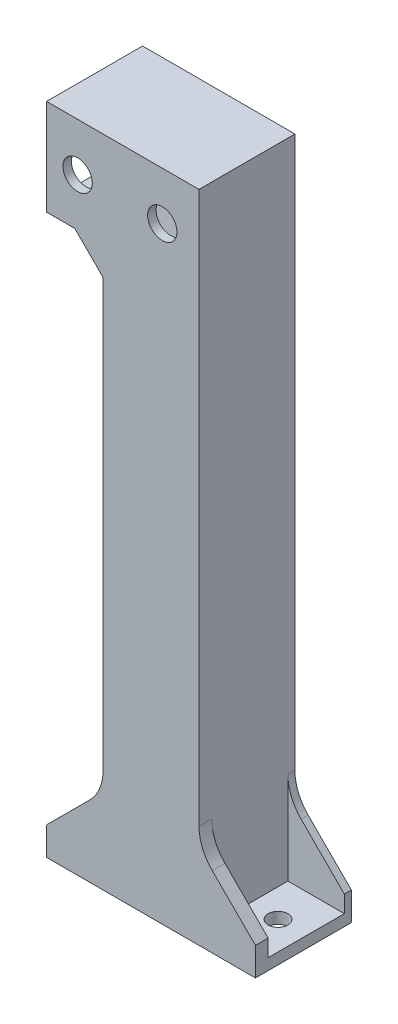
from build123d import *

# Parameters (mm, degrees)
BASE_SHAPE_DEPTH    = 17
SKETCH4_W           = 10
SKETCH4_H           = 13.5
WING_CUT_OUTS_DEPTH = 16.5
SKETCH5_R           = 1.75
WING_HOLES_DEPTH    = 119.380741677
SKETCH7_W           = 14
SKETCH7_H           = 14
CUT_EXTRUDE1_DEPTH  = 114.5
SKETCH8_W           = 14
SKETCH8_H           = 14
CUT_EXTRUDE2_DEPTH  = 25.5
CUT_EXTRUDE3_DEPTH  = 14
SKETCH10_R          = 2.6
CUT_EXTRUDE4_DEPTH  = 121.307938225


with BuildPart() as part:
    # Sketch1 → Base Shape (new body)
    with BuildSketch(Plane.XY):
        with BuildLine():
            Line((0, 18.313708499), (0, 94))
            Line((0, 94), (-5, 99))
            Line((-5, 99), (-10, 99))
            Line((-10, 99), (-10, 116))
            Line((-10, 116), (17, 116))
            Line((17, 116), (17, 18.313708499))
            ThreePointArc((17, 18.313708499), (17.60896374, 15.25224104), (19.343145751, 12.656854249))
            Line((19.343145751, 12.656854249), (27, 5))
            Line((27, 5), (27, 0))
            Line((27, 0), (17, 0))
            Line((17, 0), (0, 0))
            Line((0, 0), (-10, 0))
            Line((-10, 0), (-10, 5))
            Line((-10, 5), (-2.343145751, 12.656854249))
            ThreePointArc((-2.343145751, 12.656854249), (-0.60896374, 15.25224104), (0, 18.313708499))
        make_face()
    extrude(amount=BASE_SHAPE_DEPTH)

    # Sketch4 → Wing Cut Outs (cut)
    with BuildSketch(Plane(origin=(0, 2, 0), x_dir=(-1, 0, 0), z_dir=(0, -1, 0))):
        with Locations((5, -8)):
            Rectangle(SKETCH4_W, SKETCH4_H)
    wing_cut_outs = extrude(amount=-WING_CUT_OUTS_DEPTH, mode=Mode.SUBTRACT)

    # Sketch5 → Wing Holes (cut, through all)
    with BuildSketch(Plane(origin=(0, 2, 0), x_dir=(-1, 0, 0), z_dir=(0, -1, 0))):
        with Locations(Location((5, -8, 0), (0, 0, 180))):
            Circle(SKETCH5_R)
    wing_holes = extrude(amount=WING_HOLES_DEPTH, mode=Mode.SUBTRACT)

    # Mirror1: Wing Cut Outs across plane
    add(wing_cut_outs.mirror(Plane(origin=(8.5, 0, 0), x_dir=(0, 0, 1), z_dir=(1, 0, 0))), mode=Mode.SUBTRACT)

    # Mirror2: Wing Holes across plane
    add(wing_holes.mirror(Plane(origin=(8.5, 0, 0), x_dir=(0, 0, 1), z_dir=(1, 0, 0))), mode=Mode.SUBTRACT)

    # Sketch7 → Cut-Extrude1 (cut)
    with BuildSketch(Plane(origin=(0, 0, 0), x_dir=(1, 0, 0), z_dir=(0, 1, 0))):
        with Locations((8.5, -8.5)):
            Rectangle(SKETCH7_W, SKETCH7_H)
    extrude(amount=CUT_EXTRUDE1_DEPTH, mode=Mode.SUBTRACT)

    # Sketch8 → Cut-Extrude2 (cut)
    with BuildSketch(Plane(origin=(-10, 0, 0), x_dir=(0, 0, -1), z_dir=(1, 0, 0))):
        with Locations((-8.5, 107.5)):
            Rectangle(SKETCH8_W, SKETCH8_H)
    extrude(amount=CUT_EXTRUDE2_DEPTH, mode=Mode.SUBTRACT)

    # Sketch9 → Cut-Extrude3 (cut)
    with BuildSketch(Plane.XY.offset(1.5)):
        Polygon((1.5, 94.621320344), (-4.378679656, 100.5), (1.5, 100.5), align=None)
    extrude(amount=CUT_EXTRUDE3_DEPTH, mode=Mode.SUBTRACT)

    # Sketch10 → Cut-Extrude4 (cut, through all)
    with BuildSketch(Plane.XY):
        with Locations((10.5, 107.5)):
            Circle(SKETCH10_R)
        with Locations((-4.5, 107.5)):
            Circle(SKETCH10_R)
    extrude(amount=CUT_EXTRUDE4_DEPTH, mode=Mode.SUBTRACT)


solid = part.part
